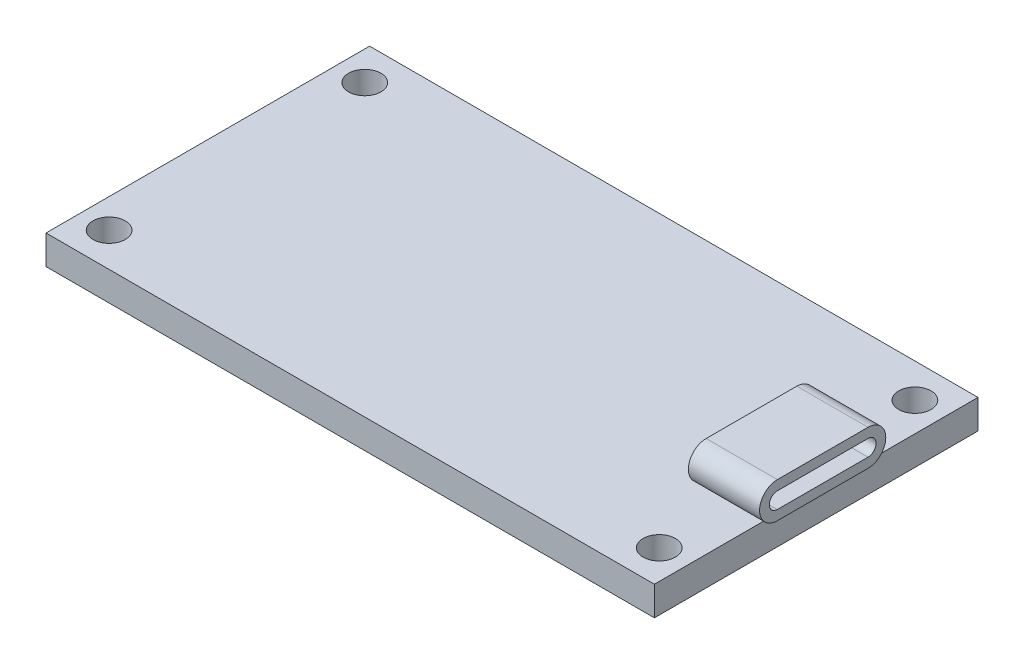
from build123d import *

# Parameters (mm, degrees)
SKETCH1_W                = 47.752
SKETCH1_H                = 25.4
SKETCH1_R                = 1.27
BOSS_EXTRUDE1_DEPTH      = 2.286
BOSS_EXTRUDE2_DEPTH      = 0.508
BOSS_EXTRUDE2_DEPTH_BACK = 5.08
CUT_EXTRUDE1_DEPTH       = 4.064


with BuildPart() as part:
    # Sketch1 → Boss-Extrude1 (new body)
    with BuildSketch(Plane(origin=(0, 0, 0), x_dir=(1, 0, 0), z_dir=(0, 1, 0))):
        Rectangle(SKETCH1_W, SKETCH1_H)
        with Locations(Location((-21.59, 10.033, 0), (0, 0, 270))):
            Circle(SKETCH1_R, mode=Mode.SUBTRACT)
        with Locations(Location((21.59, 10.033, 0), (0, 0, 270))):
            Circle(SKETCH1_R, mode=Mode.SUBTRACT)
        with Locations(Location((-21.59, -10.033, 0), (0, 0, 270))):
            Circle(SKETCH1_R, mode=Mode.SUBTRACT)
        with Locations(Location((21.59, -10.033, 0), (0, 0, 270))):
            Circle(SKETCH1_R, mode=Mode.SUBTRACT)
    extrude(amount=BOSS_EXTRUDE1_DEPTH)

    # Sketch2 → Boss-Extrude2 (add, two sides: drawn at the far end of the back side and taken through both)
    with BuildSketch(Plane(origin=(23.876, 0, 0), x_dir=(0, 0, -1), z_dir=(1, 0, 0)).offset(-BOSS_EXTRUDE2_DEPTH_BACK)):
        with BuildLine():
            Line((-3.556, 5.08), (3.556, 5.08))
            ThreePointArc((3.556, 5.08), (4.953, 3.683), (3.556, 2.286))
            Line((3.556, 2.286), (-3.556, 2.286))
            ThreePointArc((-3.556, 2.286), (-4.953, 3.683), (-3.556, 5.08))
        make_face()
    extrude(amount=BOSS_EXTRUDE2_DEPTH + BOSS_EXTRUDE2_DEPTH_BACK)

    # Sketch3 → Cut-Extrude1 (cut)
    with BuildSketch(Plane(origin=(24.384, 0, 0), x_dir=(0, 0, -1), z_dir=(1, 0, 0))):
        with BuildLine():
            Line((-3.556, 4.318), (3.556, 4.318))
            ThreePointArc((3.556, 4.318), (4.191, 3.683), (3.556, 3.048))
            Line((3.556, 3.048), (-3.556, 3.048))
            ThreePointArc((-3.556, 3.048), (-4.191, 3.683), (-3.556, 4.318))
        make_face()
    extrude(amount=-CUT_EXTRUDE1_DEPTH, mode=Mode.SUBTRACT)


solid = part.part
